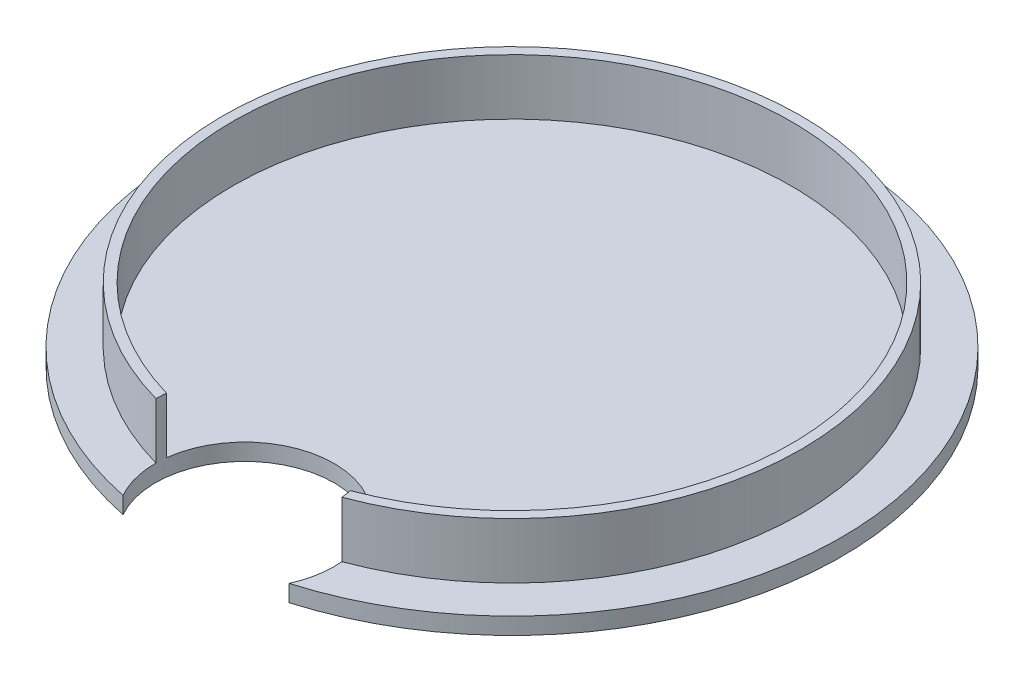
from build123d import *

# Parameters (mm, degrees)
SKETCH1_R           = 59
BOSS_EXTRUDE1_DEPTH = 3
SKETCH3_R           = 51.75
BOSS_EXTRUDE2_DEPTH = 10
SKETCH4_R           = 50
CUT_EXTRUDE2_DEPTH  = 10
SKETCH6_R           = 16
CUT_EXTRUDE4_DEPTH  = 15
SCALE1_SCALE        = 0.5


with BuildPart() as part:
    # Sketch1 → Boss-Extrude1 (new body)
    with BuildSketch(Plane(origin=(0, 0, 0), x_dir=(1, 0, 0), z_dir=(0, 1, 0))):
        with Locations(Location((0, 0, 0), (0, 0, 270))):
            Circle(SKETCH1_R)
    extrude(amount=BOSS_EXTRUDE1_DEPTH)

    # Sketch3 → Boss-Extrude2 (add)
    with BuildSketch(Plane(origin=(0, 3, 0), x_dir=(1, 0, 0), z_dir=(0, 1, 0))):
        with Locations(Location((0, 0, 0), (0, 0, 270))):
            Circle(SKETCH3_R)
    extrude(amount=BOSS_EXTRUDE2_DEPTH)

    # Sketch4 → Cut-Extrude2 (cut)
    with BuildSketch(Plane(origin=(0, 13, 0), x_dir=(1, 0, 0), z_dir=(0, 1, 0))):
        with Locations(Location((0, 0, 0), (0, 0, 270))):
            Circle(SKETCH4_R)
    extrude(amount=-CUT_EXTRUDE2_DEPTH, mode=Mode.SUBTRACT)

    # Sketch6 → Cut-Extrude4 (cut)
    with BuildSketch(Plane(origin=(0, 13, 0), x_dir=(1, 0, 0), z_dir=(0, 1, 0))):
        with Locations((2.110398292, -49.955442337)):
            Circle(SKETCH6_R)
    extrude(amount=-CUT_EXTRUDE4_DEPTH, mode=Mode.SUBTRACT)


with BuildPart() as part_1:
    # Scale1: scaled about (-0.143850324, 2.411415786, -3.405094959)
    add(part.part.scale(SCALE1_SCALE).moved(Location((-0.071925162, 1.205707893, -1.702547479))))


solid = part_1.part
